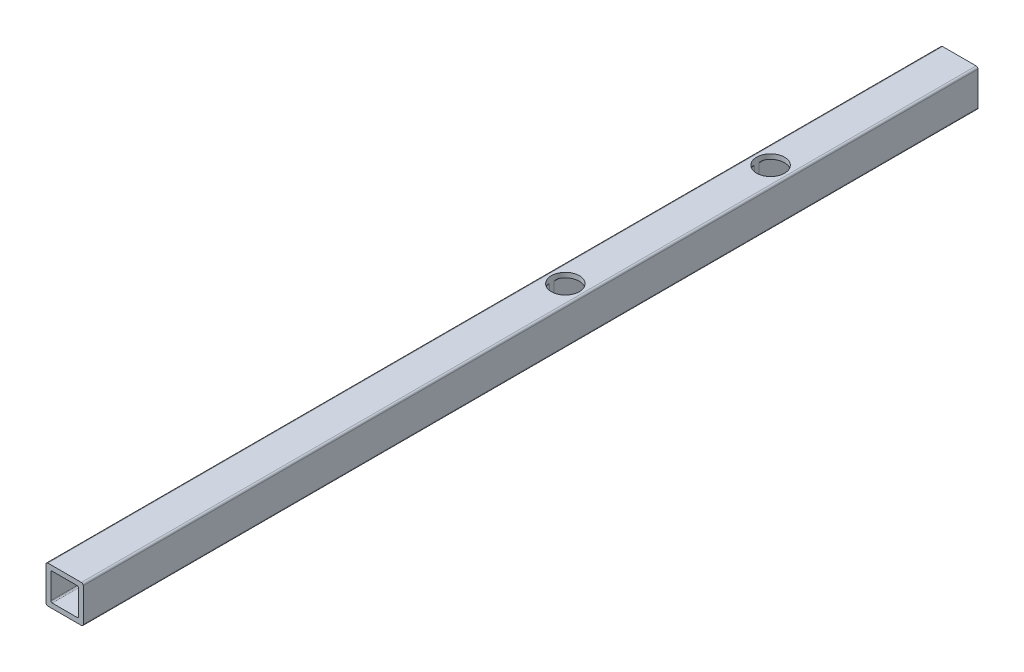
from build123d import *

# Parameters (mm, degrees)
BOSS_EXTRUDE1_DEPTH          = 152.4
BOSS_EXTRUDE1_DEPTH_BACK     = 152.4
F_3_8_0_375_DIAMETER_HOLE1_D = 9.525
F_3_8_0_375_DIAMETER_HOLE2_D = 9.525


with BuildPart() as part:
    # Sketch4 → Boss-Extrude1 (new, two sides: drawn at the far end of the back side and taken through both)
    with BuildSketch(Plane.XY.offset(-BOSS_EXTRUDE1_DEPTH_BACK)):
        with BuildLine():
            Line((6.35, -5.715), (6.35, 5.715))
            ThreePointArc((6.35, 5.715), (6.164012806, 6.164012806), (5.715, 6.35))
            Line((5.715, 6.35), (-5.715, 6.35))
            ThreePointArc((-5.715, 6.35), (-6.164012806, 6.164012806), (-6.35, 5.715))
            Line((-6.35, 5.715), (-6.35, -5.715))
            ThreePointArc((-6.35, -5.715), (-6.164012806, -6.164012806), (-5.715, -6.35))
            Line((-5.715, -6.35), (5.715, -6.35))
            ThreePointArc((5.715, -6.35), (6.164012806, -6.164012806), (6.35, -5.715))
        make_face()
        with BuildLine():
            Line((4.699, 4.2291), (4.699, -4.2291))
            ThreePointArc((4.699, -4.2291), (4.561369476, -4.561369476), (4.2291, -4.699))
            Line((4.2291, -4.699), (-4.2291, -4.699))
            ThreePointArc((-4.2291, -4.699), (-4.561369476, -4.561369476), (-4.699, -4.2291))
            Line((-4.699, -4.2291), (-4.699, 4.2291))
            ThreePointArc((-4.699, 4.2291), (-4.561369476, 4.561369476), (-4.2291, 4.699))
            Line((-4.2291, 4.699), (4.2291, 4.699))
            ThreePointArc((4.2291, 4.699), (4.561369476, 4.561369476), (4.699, 4.2291))
        make_face(mode=Mode.SUBTRACT)
    extrude(amount=BOSS_EXTRUDE1_DEPTH + BOSS_EXTRUDE1_DEPTH_BACK)

    # 3/8 (0.375) Diameter Hole1 (through all)
    with Locations(Plane(origin=(0, 6.35, 0), x_dir=(1, 0, 0), z_dir=(0, 1, 0))):
        with Locations((0, 88.088749974)):
            Hole(F_3_8_0_375_DIAMETER_HOLE1_D / 2)

    # 3/8 (0.375) Diameter Hole2 (through all)
    with Locations(Plane(origin=(0, 6.35, 0), x_dir=(1, 0, 0), z_dir=(0, 1, 0))):
        with Locations((0, 18.166595951)):
            Hole(F_3_8_0_375_DIAMETER_HOLE2_D / 2)


solid = part.part
